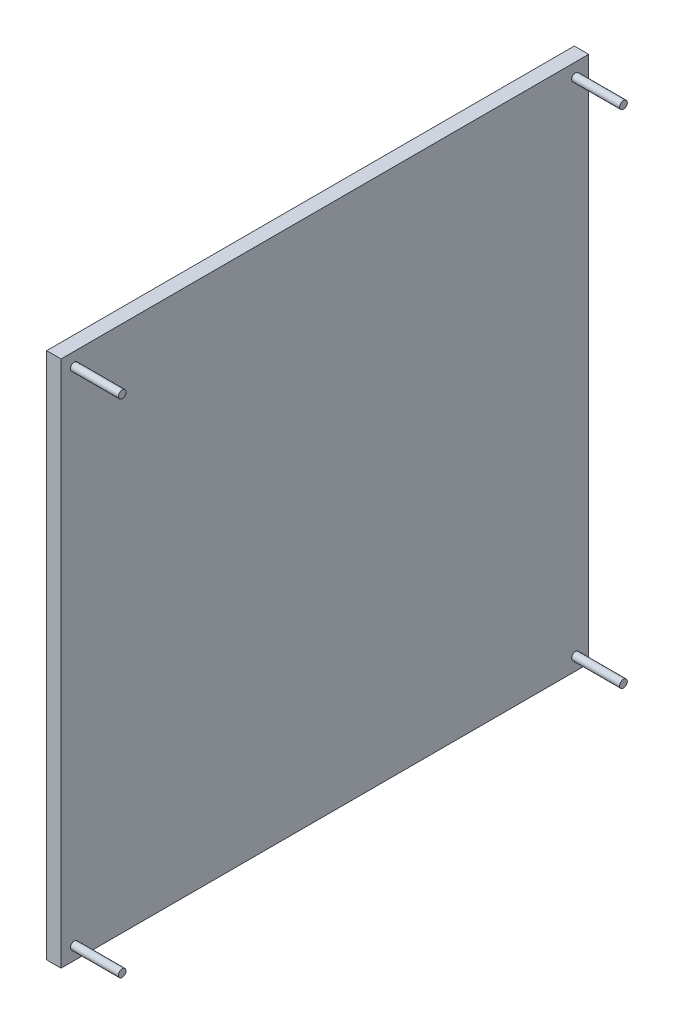
from build123d import *

# Parameters (mm, degrees)
SKETCH_1_W           = 220
SKETCH_1_H           = 220
SKETCH_1_R           = 1.6
EXTRUDE_1_DEPTH      = 6
EXTRUDE_2_DEPTH      = 20
EXTRUDE_2_DEPTH_BACK = 6
SKETCH_2_R           = 1.6


with BuildPart() as part:
    # 草图1 → 凸台-拉伸1 (new body)
    with BuildSketch(Plane(origin=(0, 0, 0), x_dir=(0, 0, -1), z_dir=(1, 0, 0))):
        with Locations((-23.204600907, 15.424234721)):
            Rectangle(SKETCH_1_W, SKETCH_1_H)
        with Locations((81.295399093, 119.924234721)):
            Circle(SKETCH_1_R, mode=Mode.SUBTRACT)
        with Locations((-127.704600907, 119.924234721)):
            Circle(SKETCH_1_R, mode=Mode.SUBTRACT)
        with Locations((-127.704600907, -89.075765279)):
            Circle(SKETCH_1_R, mode=Mode.SUBTRACT)
        with Locations((81.295399093, -89.075765279)):
            Circle(SKETCH_1_R, mode=Mode.SUBTRACT)
    extrude(amount=EXTRUDE_1_DEPTH)

    # 草图2 → 凸台-拉伸2 (add, two sides: drawn at the far end of the back side and taken through both)
    with BuildSketch(Plane(origin=(6, 0, 0), x_dir=(0, 0, -1), z_dir=(1, 0, 0)).offset(-EXTRUDE_2_DEPTH_BACK)):
        with Locations((81.295399093, -89.075765279)):
            Circle(SKETCH_2_R)
        with Locations((-127.704600907, -89.075765279)):
            Circle(SKETCH_2_R)
        with Locations((81.295399093, 119.924234721)):
            Circle(SKETCH_2_R)
        with Locations((-127.704600907, 119.924234721)):
            Circle(SKETCH_2_R)
    extrude(amount=EXTRUDE_2_DEPTH + EXTRUDE_2_DEPTH_BACK)


solid = part.part
